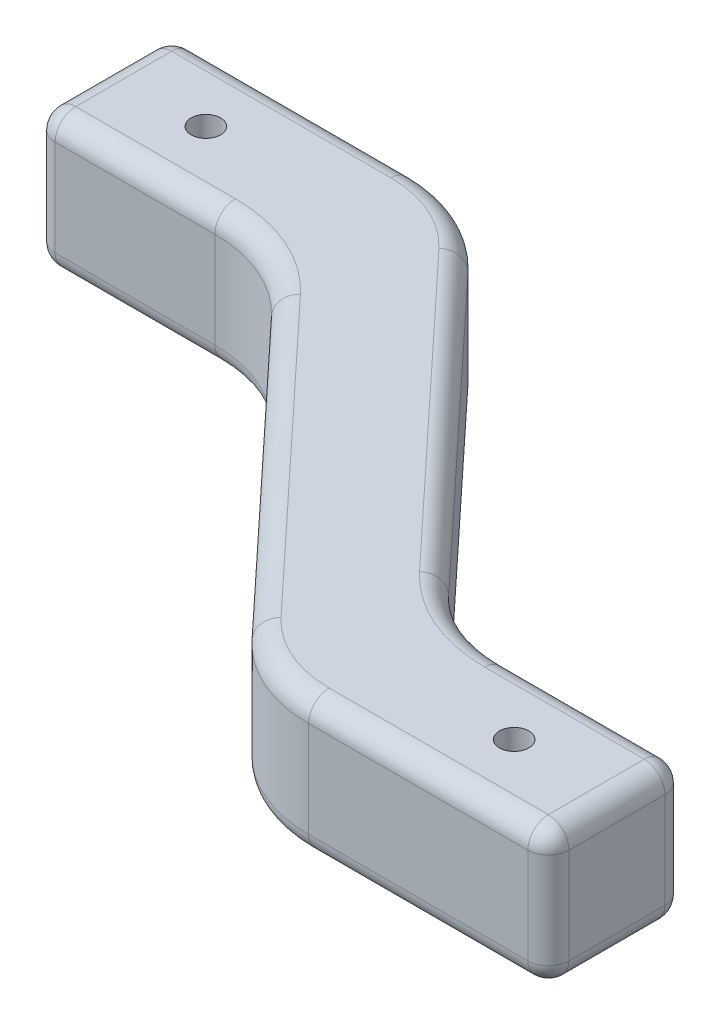
from build123d import *

# Parameters (mm, degrees)
CROQUIS1_R              = 2.15
SALIENTE_EXTRUIR1_DEPTH = 20
REDONDEO1_R             = 20
REDONDEO2_R             = 3


with BuildPart() as part:
    # Croquis1 → Saliente-Extruir1 (new body)
    with BuildSketch(Plane(origin=(0, 0, 0), x_dir=(1, 0, 0), z_dir=(0, 1, 0))):
        Polygon((-65, 0), (-21.305768696, 0), (30, -55), (65, -55), (65, -75), (21.305768696, -75), (-30, -20), (-65, -20), align=None)
        with Locations(Location((-50, -10, 0), (0, 0, 270))):
            Circle(CROQUIS1_R, mode=Mode.SUBTRACT)
        with Locations(Location((50, -65, 0), (0, 0, 270))):
            Circle(CROQUIS1_R, mode=Mode.SUBTRACT)
    extrude(amount=SALIENTE_EXTRUIR1_DEPTH)

    # Redondeo1
    redondeo1_edges = [part.edges().sort_by_distance(p)[0] for p in [
        (-21.305768696, 10, 0),
        (30, 10, 55),
        (21.305768696, 10, 75),
        (-30, 10, 20),
    ]]
    fillet(redondeo1_edges, radius=REDONDEO1_R)

    # Redondeo2
    redondeo2_edges = [part.edges().sort_by_distance(p)[0] for p in [
        (-51.847115652, 0, 20),
        (-65, 0, 10),
        (-65, 10, 0),
        (65, 10, 55),
        (65, 10, 75),
        (-65, 10, 20),
        (65, 20, 65),
        (51.847115652, 20, 55),
        (47.5, 0, 75),
        (47.5, 20, 75),
        (-47.5, 0, 0),
        (4.347115652, 0, 27.5),
        (-4.347115652, 0, 47.5),
        (-22.026573691, 0, 1.658122427),
        (22.026573691, 0, 73.341877573),
        (-4.347115652, 20, 47.5),
        (4.347115652, 20, 27.5),
        (-47.5, 20, 0),
        (-22.026573691, 20, 1.658122427),
        (22.026573691, 20, 73.341877573),
        (30.720804996, 0, 53.341877573),
        (30.720804996, 20, 53.341877573),
        (-30.720804996, 0, 21.658122427),
        (-30.720804996, 20, 21.658122427),
        (-65, 20, 10),
        (-51.847115652, 20, 20),
        (51.847115652, 0, 55),
        (65, 0, 65),
    ]]
    fillet(redondeo2_edges, radius=REDONDEO2_R)


solid = part.part
